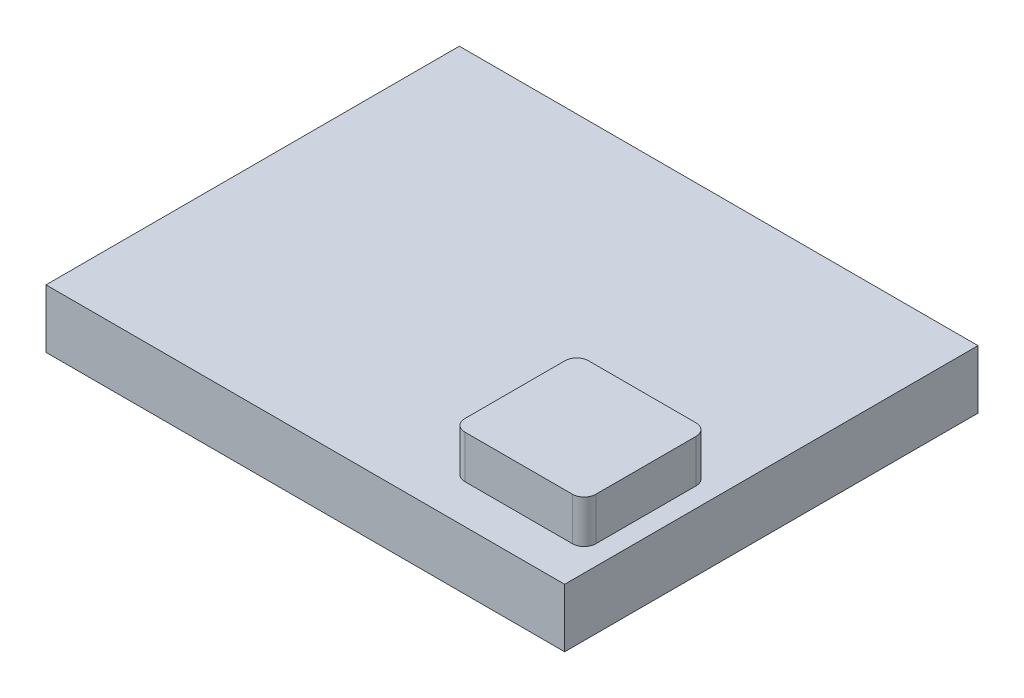
from build123d import *

# Parameters (mm, degrees)
SKETCH_1_W      = 13.3
SKETCH_1_H      = 10.6
EXTRUDE_1_DEPTH = 1.5
SKETCH_2_W      = 3.36
SKETCH_2_H      = 3.17
EXTRUDE_2_DEPTH = 1.1
FILLET_1_R      = 0.3


with BuildPart() as part:
    # Эскиз1 → Бобышка-Вытянуть1 (new body)
    with BuildSketch(Plane(origin=(0, 0, 0), x_dir=(1, 0, 0), z_dir=(0, 1, 0))):
        Rectangle(SKETCH_1_W, SKETCH_1_H)
    extrude(amount=EXTRUDE_1_DEPTH)


with BuildPart() as body_2:
    # Эскиз2 → Бобышка-Вытянуть2 (new body)
    with BuildSketch(Plane(origin=(0, 1.5, 0), x_dir=(1, 0, 0), z_dir=(0, 1, 0))):
        with Locations((4.47, -2.715)):
            Rectangle(SKETCH_2_W, SKETCH_2_H)
    extrude(amount=EXTRUDE_2_DEPTH)

    # Скругление1
    fillet_1_edges = [body_2.edges().sort_by_distance(p)[0] for p in [
        (6.15, 2.05, 4.3),
        (2.79, 2.05, 4.3),
        (2.79, 2.05, 1.13),
        (6.15, 2.05, 1.13),
    ]]
    fillet(fillet_1_edges, radius=FILLET_1_R)


solid = Compound([part.part, body_2.part])
